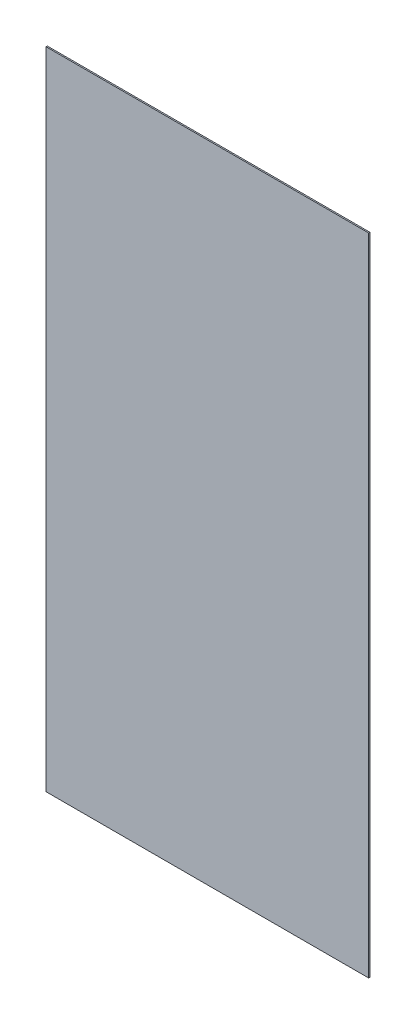
from build123d import *

# Parameters (mm, degrees)
SKETCH1_W           = 2500
SKETCH1_H           = 5000
BOSS_EXTRUDE1_DEPTH = 10


with BuildPart() as part:
    # Sketch1 → Boss-Extrude1 (new body)
    with BuildSketch(Plane.XY):
        Rectangle(SKETCH1_W, SKETCH1_H)
    extrude(amount=BOSS_EXTRUDE1_DEPTH)


solid = part.part
